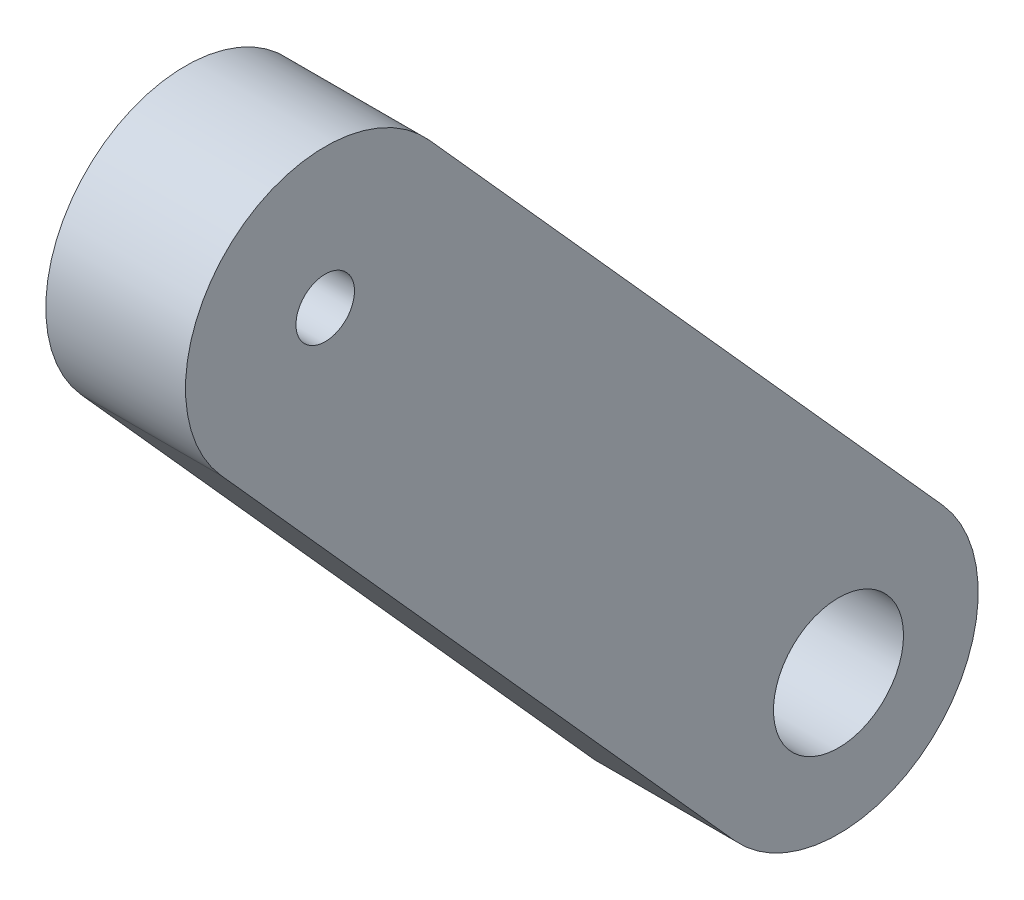
from build123d import *

# Parameters (mm, degrees)
SKETCH1_R           = 2.2225
SKETCH1_R_2         = 1
BOSS_EXTRUDE1_DEPTH = 4.7752


with BuildPart() as part:
    # Sketch1 → Boss-Extrude1 (new body)
    with BuildSketch(Plane(origin=(-23.062789717, 0, 0), x_dir=(0, 0, -1), z_dir=(1, 0, 0))):
        with BuildLine():
            Line((-17.620819978, 16.411530589), (-0.077206179, -3.162933901))
            ThreePointArc((-0.077206179, -3.162933901), (-0.446141306, -9.906001226), (-7.189208631, -9.537066099))
            Line((-7.189208631, -9.537066099), (-24.73282243, 10.037398391))
            ThreePointArc((-24.73282243, 10.037398391), (-24.363887303, 16.780465716), (-17.620819978, 16.411530589))
        make_face()
        with Locations((-3.633207405, -6.35)):
            Circle(SKETCH1_R, mode=Mode.SUBTRACT)
        with Locations((-21.176821204, 13.22446449)):
            Circle(SKETCH1_R_2, mode=Mode.SUBTRACT)
    extrude(amount=BOSS_EXTRUDE1_DEPTH)


solid = part.part
